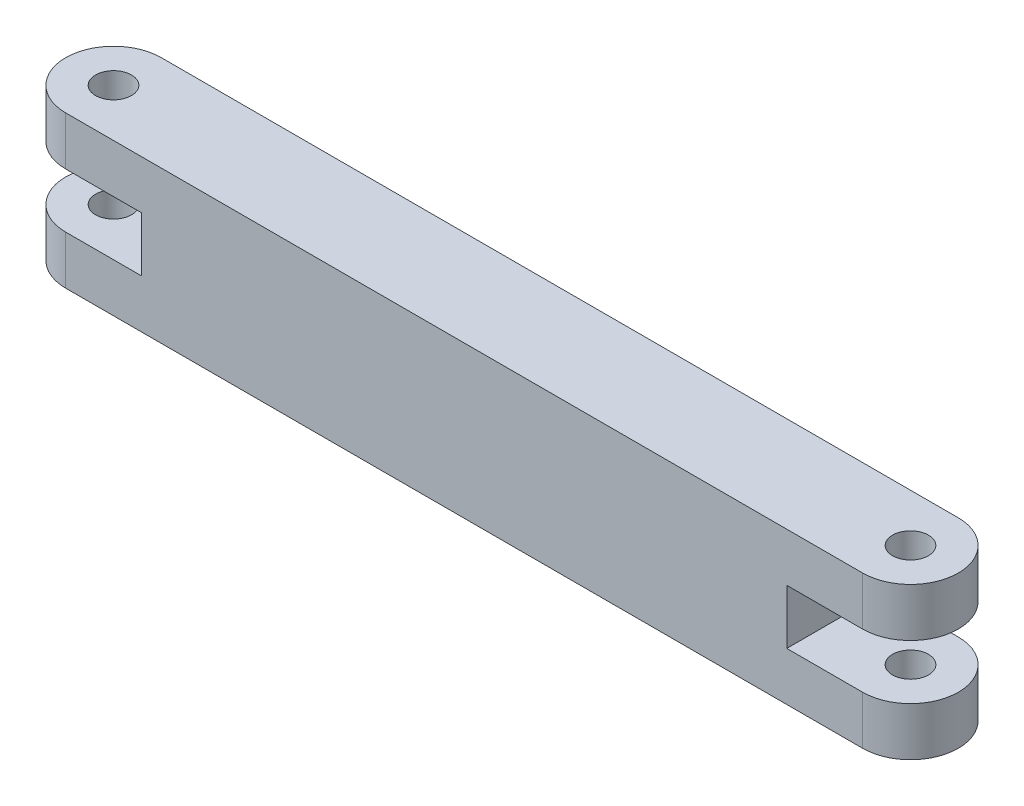
from build123d import *

# Parameters (mm, degrees)
SKETCH1_R           = 2.25
BOSS_EXTRUDE1_DEPTH = 19.05
SKETCH2_W           = 23.025
SKETCH2_H           = 6.858
CUT_EXTRUDE1_DEPTH  = 19.05


with BuildPart() as part:
    # Sketch1 → Boss-Extrude1 (new body)
    with BuildSketch(Plane(origin=(0, 0, 0), x_dir=(1, 0, 0), z_dir=(0, 1, 0))):
        with BuildLine():
            Line((0, 6), (100, 6))
            ThreePointArc((100, 6), (106, 0), (100, -6))
            Line((100, -6), (0, -6))
            ThreePointArc((0, -6), (-6, 0), (0, 6))
        make_face()
        Circle(SKETCH1_R, mode=Mode.SUBTRACT)
        with Locations((100, 0)):
            Circle(SKETCH1_R, mode=Mode.SUBTRACT)
    extrude(amount=BOSS_EXTRUDE1_DEPTH)

    # Sketch2 → Cut-Extrude1 (cut)
    with BuildSketch(Plane(origin=(0, 0, -6), x_dir=(-1, 0, 0), z_dir=(0, 0, -1))):
        with Locations((1.9875, 9.525)):
            Rectangle(SKETCH2_W, SKETCH2_H)
    cut_extrude1 = extrude(amount=-CUT_EXTRUDE1_DEPTH, mode=Mode.SUBTRACT)

    # Mirror1: Cut-Extrude1 across plane
    add(cut_extrude1.mirror(Plane(origin=(50, 0, 0), x_dir=(0, 0, 1), z_dir=(1, 0, 0))), mode=Mode.SUBTRACT)


solid = part.part
